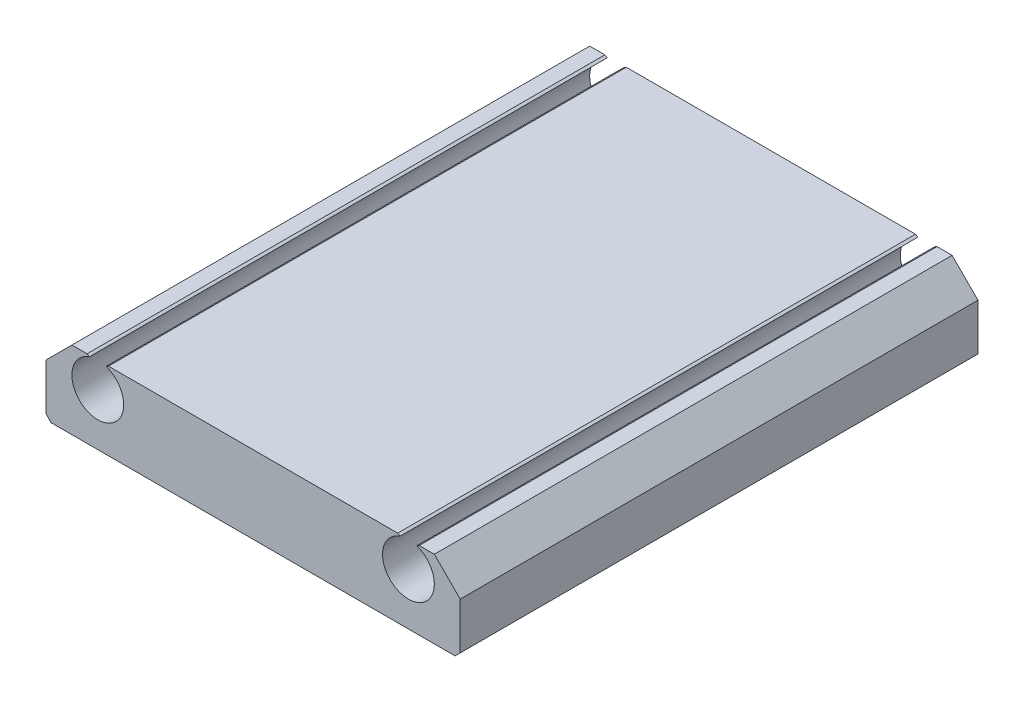
from build123d import *

# Parameters (mm, degrees)
DODANIE_WYCI_GNI_CIE1_DEPTH    = 100
WYTNIJ_WYCI_GNI_CIE1_DEPTH     = 5
OTW_R_GWINTOWANY_1_4_201_D     = 5.1054
OTW_R_GWINTOWANY_1_4_201_DEPTH = 8.64
OTW_R_GWINTOWANY_1_4_201_TIP   = 1.533816902


with BuildPart() as part:
    # Szkic1 → Dodanie-wyciągnięcie1 (new body)
    with BuildSketch(Plane.XY):
        with BuildLine():
            Line((27.92734735, 15), (28.389677427, 14.733588619))
            ThreePointArc((28.389677427, 14.733588619), (30, 5), (31.610322573, 14.733588619))
            Line((31.610322573, 14.733588619), (32.07265265, 15))
            Line((32.07265265, 15), (35, 15))
            Line((35, 15), (40, 10))
            Line((40, 10), (40, 1))
            Line((40, 1), (39, 0))
            Line((39, 0), (-39, 0))
            Line((-39, 0), (-40, 1))
            Line((-40, 1), (-40, 10))
            Line((-40, 10), (-35, 15))
            Line((-35, 15), (-32.07265265, 15))
            Line((-32.07265265, 15), (-31.610322573, 14.733588619))
            ThreePointArc((-31.610322573, 14.733588619), (-30, 5), (-28.389677427, 14.733588619))
            Line((-28.389677427, 14.733588619), (-27.92734735, 15))
            Line((-27.92734735, 15), (27.92734735, 15))
        make_face()
    extrude(amount=DODANIE_WYCI_GNI_CIE1_DEPTH)

    # Szkic2 → Wytnij-wyciągnięcie1 (cut)
    with BuildSketch(Plane(origin=(0, 0, 0), x_dir=(-1, 0, 0), z_dir=(0, -1, 0))):
        with BuildLine():
            Line((-24.299393508, -5), (-0.317489033, -45.533191657))
            ThreePointArc((-0.317489033, -45.533191657), (-0.177941432, -45.716925413), (0, -45.863787501))
            ThreePointArc((0, -45.863787501), (0.177941432, -45.716925413), (0.317489033, -45.533191657))
            Line((0.317489033, -45.533191657), (24.281729572, -5))
            Line((24.281729572, -5), (-24.299393508, -5))
        make_face()
        with BuildLine():
            Line((2.408314264, -54.073430305), (26.605129776, -95))
            Line((26.605129776, -95), (26.605129776, -5))
            Line((26.605129776, -5), (2.214243, -45.750943625))
            ThreePointArc((2.214243, -45.750943625), (2.086974186, -46.435257956), (2.437074489, -47.036850202))
            ThreePointArc((2.437074489, -47.036850202), (3.835217741, -49.896589795), (2.593210084, -52.827516622))
            ThreePointArc((2.593210084, -52.827516622), (2.279954566, -53.41770522), (2.408314264, -54.073430305))
        make_face()
        with BuildLine():
            Line((-24.302635093, -95), (24.281729572, -95))
            Line((24.281729572, -95), (0.200251555, -54.268512505))
            ThreePointArc((0.200251555, -54.268512505), (0.109677176, -54.139680814), (0, -54.02666648))
            ThreePointArc((0, -54.02666648), (-0.109677176, -54.139680814), (-0.200251555, -54.268512505))
            Line((-0.200251555, -54.268512505), (-24.302635093, -95))
        make_face()
        with BuildLine():
            ThreePointArc((-2.437074489, -47.036850202), (-2.086974186, -46.435257956), (-2.214243, -45.750943625))
            Line((-2.214243, -45.750943625), (-26.605129776, -5))
            Line((-26.605129776, -5), (-26.605129776, -95))
            Line((-26.605129776, -95), (-2.205174034, -54.256813529))
            ThreePointArc((-2.205174034, -54.256813529), (-2.077967373, -53.571197168), (-2.429779642, -52.9691345))
            ThreePointArc((-2.429779642, -52.9691345), (-3.836608728, -50.004717824), (-2.437074489, -47.036850202))
        make_face()
    extrude(amount=-WYTNIJ_WYCI_GNI_CIE1_DEPTH, mode=Mode.SUBTRACT)

    # Otwór gwintowany 1/4-201
    with Locations(Plane(origin=(0, 0, 50), x_dir=(0, 0, -1), z_dir=(0, -1, 0))):
        with Locations((0, 0)):
            Hole(OTW_R_GWINTOWANY_1_4_201_D / 2, depth=OTW_R_GWINTOWANY_1_4_201_DEPTH)
            with Locations((0, 0, -(OTW_R_GWINTOWANY_1_4_201_DEPTH + OTW_R_GWINTOWANY_1_4_201_TIP / 2))):  # 118° drill point
                Cone(0, OTW_R_GWINTOWANY_1_4_201_D / 2, OTW_R_GWINTOWANY_1_4_201_TIP, mode=Mode.SUBTRACT)


solid = part.part
